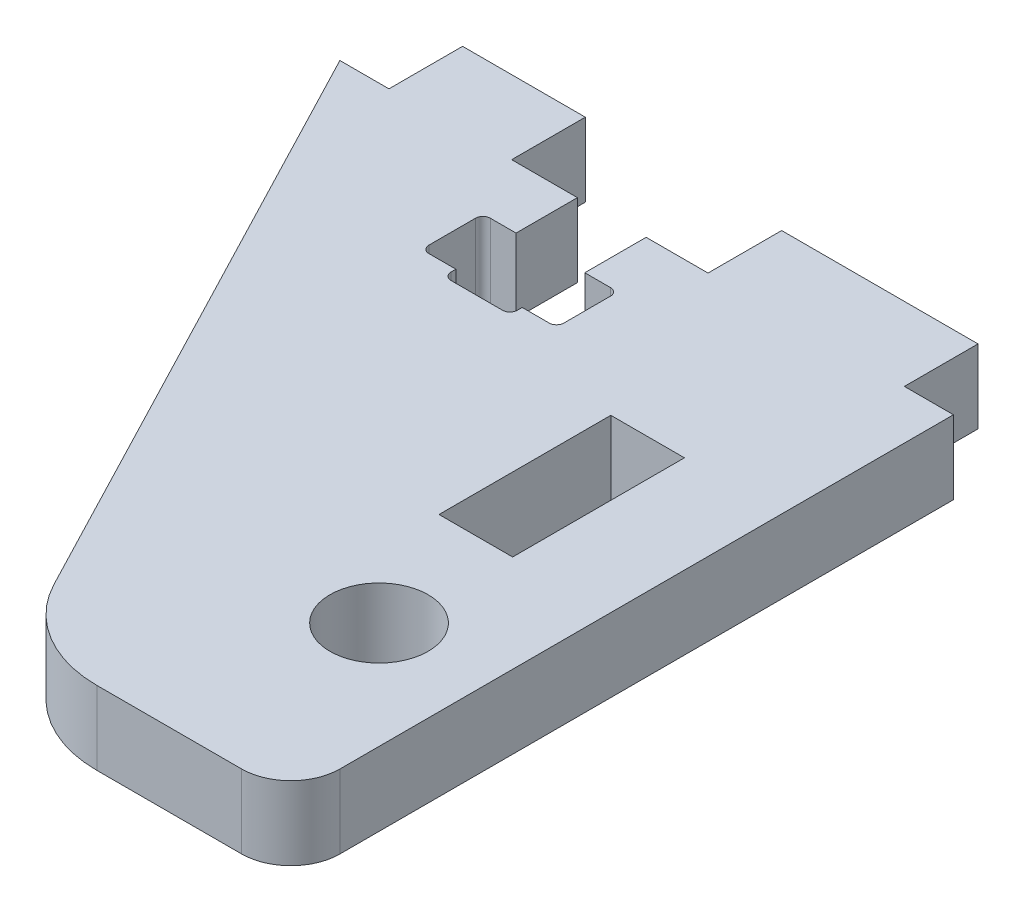
from build123d import *

# Parameters (mm, degrees)
SKETCH_1_W          = 25
SKETCH_1_H          = 5
EXTRUDE_1_DEPTH     = 24
SKETCH_2_W          = 5
SKETCH_2_H          = 5
SKETCH_2_W_2        = 8
EXTRUDE_2_DEPTH     = 3
CUT_EXTRUDE_2_DEPTH = 5
EXTRUDE_3_DEPTH     = 5
FILLET_1_R          = 5
FILLET_2_R          = 2
CUT_EXTRUDE_4_DEPTH = 2
CUT_EXTRUDE_5_DEPTH = 3
SKETCH_9_R          = 2
CUT_EXTRUDE_6_DEPTH = 3
SKETCH_10_W         = 7
SKETCH_10_H         = 3
CUT_EXTRUDE_7_DEPTH = 3


with BuildPart() as part:
    # 草图1 → 凸台-拉伸1 (new body)
    with BuildSketch(Plane.XY):
        with Locations((12.5, 2.5)):
            Rectangle(SKETCH_1_W, SKETCH_1_H)
    extrude(amount=EXTRUDE_1_DEPTH)

    # 草图2 → 凸台-拉伸2 (add)
    with BuildSketch(Plane(origin=(0, 0, 0), x_dir=(-1, 0, 0), z_dir=(0, 0, -1))):
        with Locations((-4.5, 2.5)):
            Rectangle(SKETCH_2_W, SKETCH_2_H)
        with Locations((-19, 2.5)):
            Rectangle(SKETCH_2_W_2, SKETCH_2_H)
    extrude(amount=EXTRUDE_2_DEPTH)

    # 草图3 → 切除-拉伸2 (cut)
    with BuildSketch(Plane.XZ):
        Polygon((12.5, 24), (0, 24), (0, 0), align=None)
    extrude(amount=-CUT_EXTRUDE_2_DEPTH, mode=Mode.SUBTRACT)

    # 草图4 → 凸台-拉伸3 (add)
    with BuildSketch(Plane.XZ):
        Polygon((12.5, 24), (25, 24), (25, 27), (14.0625, 27), align=None)
    extrude(amount=-EXTRUDE_3_DEPTH)

    # 圆角1
    fillet_1_edges = [part.edges().sort_by_distance(p)[0] for p in [
        (14.0625, 2.5, 27),
    ]]
    fillet(fillet_1_edges, radius=FILLET_1_R)

    # 圆角2
    fillet_2_edges = [part.edges().sort_by_distance(p)[0] for p in [
        (25, 2.5, 27),
    ]]
    fillet(fillet_2_edges, radius=FILLET_2_R)

    # 草图7 → 切除-拉伸4 (cut)
    with BuildSketch(Plane(origin=(0, 5, 0), x_dir=(1, 0, 0), z_dir=(0, 1, 0))):
        with BuildLine():
            Line((17.09585797, -27), (23, -27))
            ThreePointArc((23, -27), (24.414213562, -26.414213562), (25, -25))
            Line((25, -25), (25, 0))
            Line((25, 0), (23, 0))
            Line((23, 0), (23, 3))
            Line((23, 3), (15, 3))
            Line((15, 3), (15, 0))
            Line((15, 0), (7, 0))
            Line((7, 0), (7, 3))
            Line((7, 3), (2, 3))
            Line((2, 3), (2, 0))
            Line((2, 0), (0, 0))
            Line((0, 0), (12.661287549, -24.309672094))
            ThreePointArc((12.661287549, -24.309672094), (14.502439422, -26.274831018), (17.09585797, -27))
        make_face()
    extrude(amount=-CUT_EXTRUDE_4_DEPTH, mode=Mode.SUBTRACT)

    # 草图8 → 切除-拉伸5 (cut)
    with BuildSketch(Plane(origin=(38.221211183, 0, -111.620742166), x_dir=(0, 0, -1), z_dir=(0, -1, 0))):
        with BuildLine():
            Line((-114.120742166, -28.543003338), (-111.620742166, -28.543003338))
            Line((-111.620742166, -28.543003338), (-111.620742166, -25.743003338))
            Line((-111.620742166, -25.743003338), (-114.120742166, -25.743003338))
            Line((-114.120742166, -25.743003338), (-114.120742166, -24.693003338))
            ThreePointArc((-114.120742166, -24.693003338), (-114.208610132, -24.480871304), (-114.420742166, -24.393003338))
            Line((-114.420742166, -24.393003338), (-116.320742166, -24.393003338))
            ThreePointArc((-116.320742166, -24.393003338), (-116.5328742, -24.480871304), (-116.620742166, -24.693003338))
            Line((-116.620742166, -24.693003338), (-116.620742166, -25.793003338))
            Line((-116.620742166, -25.793003338), (-116.820742166, -25.793003338))
            ThreePointArc((-116.820742166, -25.793003338), (-117.0328742, -25.880871304), (-117.120742166, -26.093003338))
            Line((-117.120742166, -26.093003338), (-117.120742166, -28.193003338))
            ThreePointArc((-117.120742166, -28.193003338), (-117.0328742, -28.405135373), (-116.820742166, -28.493003338))
            Line((-116.820742166, -28.493003338), (-116.620742166, -28.493003338))
            Line((-116.620742166, -28.493003338), (-116.620742166, -29.593003338))
            ThreePointArc((-116.620742166, -29.593003338), (-116.5328742, -29.805135373), (-116.320742166, -29.893003338))
            Line((-116.320742166, -29.893003338), (-114.420742166, -29.893003338))
            ThreePointArc((-114.420742166, -29.893003338), (-114.208610132, -29.805135373), (-114.120742166, -29.593003338))
            Line((-114.120742166, -29.593003338), (-114.120742166, -28.543003338))
        make_face()
    extrude(amount=-CUT_EXTRUDE_5_DEPTH, mode=Mode.SUBTRACT)

    # 草图9 → 切除-拉伸6 (cut)
    with BuildSketch(Plane(origin=(38.221211183, 0, -111.620742166), x_dir=(0, 0, -1), z_dir=(0, -1, 0))):
        with Locations((-130.672383052, -17.574261788)):
            Circle(SKETCH_9_R)
    extrude(amount=-CUT_EXTRUDE_6_DEPTH, mode=Mode.SUBTRACT)

    # 草图10 → 切除-拉伸7 (cut)
    with BuildSketch(Plane(origin=(38.221211183, 0, -111.620742166), x_dir=(0, 0, -1), z_dir=(0, -1, 0))):
        with Locations((-122.120742166, -18.681849587)):
            Rectangle(SKETCH_10_W, SKETCH_10_H)
    extrude(amount=-CUT_EXTRUDE_7_DEPTH, mode=Mode.SUBTRACT)


solid = part.part
